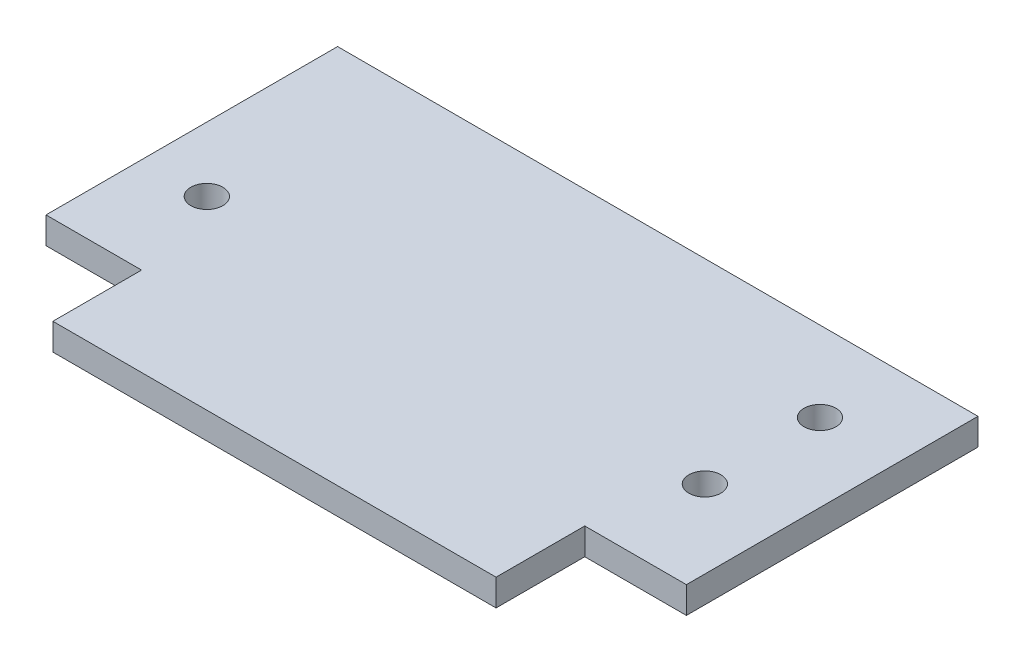
from build123d import *

# Parameters (mm, degrees)
SKETCH1_W           = 72
SKETCH1_H           = 42.7549792
BOSS_EXTRUDE1_DEPTH = 3
SKETCH2_R           = 1.8
CUT_EXTRUDE1_DEPTH  = 3
SKETCH3_W           = 10.743475017
SKETCH3_H           = 9.971995481
SKETCH3_W_2         = 11.428139851
SKETCH3_H_2         = 7.796989135
SKETCH3_H_3         = 2.175006346
CUT_EXTRUDE2_DEPTH  = 53


with BuildPart() as part:
    # Sketch1 → Boss-Extrude1 (new body)
    with BuildSketch(Plane(origin=(0, 0, 0), x_dir=(1, 0, 0), z_dir=(0, 1, 0))):
        with Locations((36, 21.3774896)):
            Rectangle(SKETCH1_W, SKETCH1_H)
    extrude(amount=BOSS_EXTRUDE1_DEPTH)

    # Sketch2 → Cut-Extrude1 (cut)
    with BuildSketch(Plane(origin=(0, 3, 0), x_dir=(1, 0, 0), z_dir=(0, 1, 0))):
        with Locations(Location((7.244076977, 20.809705714, 0), (0, 0, 270))):
            Circle(SKETCH2_R)
        with Locations(Location((63.234445615, 20.809705714, 0), (0, 0, 270))):
            Circle(SKETCH2_R)
        with Locations(Location((63.234445615, 33.7549792, 0), (0, 0, 270))):
            Circle(SKETCH2_R)
    extrude(amount=-CUT_EXTRUDE1_DEPTH, mode=Mode.SUBTRACT)

    # Sketch3 → Cut-Extrude2 (cut)
    with BuildSketch(Plane(origin=(0, 3, 0), x_dir=(1, 0, 0), z_dir=(0, 1, 0))):
        with Locations((5.371737509, 4.985997741)):
            Rectangle(SKETCH3_W, SKETCH3_H)
        with Locations((66.285930075, 6.073500914)):
            Rectangle(SKETCH3_W_2, SKETCH3_H_2)
        with Locations((66.285930075, 1.087503173)):
            Rectangle(SKETCH3_W_2, SKETCH3_H_3)
    extrude(amount=-CUT_EXTRUDE2_DEPTH, mode=Mode.SUBTRACT)


solid = part.part
